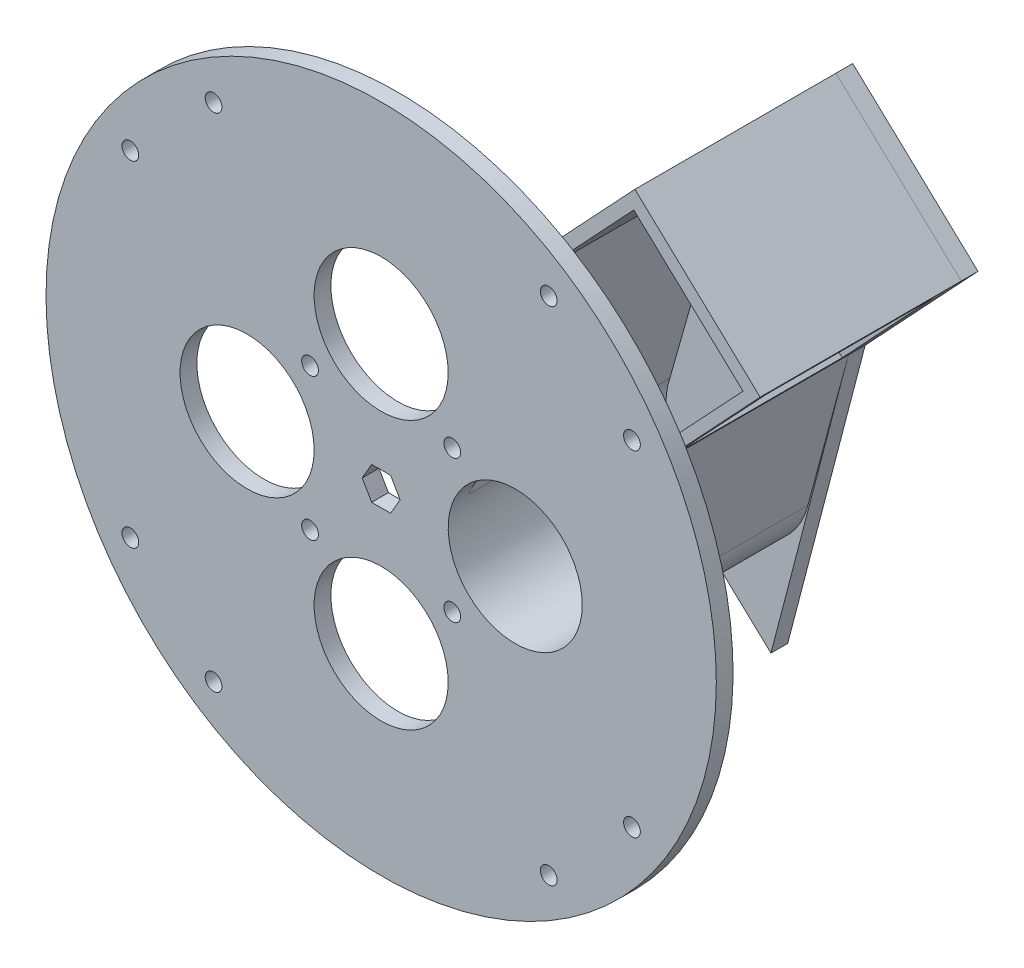
from build123d import *
from build123d.topology import SkipClean

# Parameters (mm, degrees)
SKETCH1_R           = 127
SKETCH1_R_2         = 25.4
BOSS_EXTRUDE1_DEPTH = 6.35
SKETCH3_R           = 3.175
CUT_EXTRUDE1_DEPTH  = 6.35
BOSS_EXTRUDE3_START = 76.2
BOSS_EXTRUDE3_DEPTH = 76.2
SKETCH8_W           = 63.5
SKETCH8_H           = 50.8
CUT_EXTRUDE2_DEPTH  = 6.35
BOSS_EXTRUDE4_DEPTH = 6.35


with BuildPart() as part:
    # Sketch1 → Boss-Extrude1 (new body)
    with BuildSketch(Plane.XY):
        Circle(SKETCH1_R)
        with Locations((0, 50.8)):
            Circle(SKETCH1_R_2, mode=Mode.SUBTRACT)
        with Locations((50.8, 0)):
            Circle(SKETCH1_R_2, mode=Mode.SUBTRACT)
        with Locations((0, -50.8)):
            Circle(SKETCH1_R_2, mode=Mode.SUBTRACT)
        with Locations((-50.8, 0)):
            Circle(SKETCH1_R_2, mode=Mode.SUBTRACT)
        Polygon((7.18570145, 0), (3.592850725, 6.223), (-3.592850725, 6.223), (-7.18570145, 0), (-3.592850725, -6.223), (3.592850725, -6.223), align=None, mode=Mode.SUBTRACT)
    extrude(amount=BOSS_EXTRUDE1_DEPTH)

    # Sketch3 → Cut-Extrude1 (cut)
    with BuildSketch(Plane(origin=(0, 0, 0), x_dir=(-1, 0, 0), z_dir=(0, 0, -1))):
        with Locations((-26.940768363, 26.940768363)):
            Circle(SKETCH3_R)
        with Locations((26.940768363, 26.940768363)):
            Circle(SKETCH3_R)
        with Locations((26.940768363, -26.940768363)):
            Circle(SKETCH3_R)
        with Locations((-26.940768363, -26.940768363)):
            Circle(SKETCH3_R)
        with Locations((-63.5, 95.038097624)):
            Circle(SKETCH3_R)
        with Locations((63.5, 95.038097624)):
            Circle(SKETCH3_R)
        with Locations((95.038097624, 63.5)):
            Circle(SKETCH3_R)
        with Locations((95.038097624, -63.5)):
            Circle(SKETCH3_R)
        with Locations((63.5, -95.038097624)):
            Circle(SKETCH3_R)
        with Locations((-63.5, -95.038097624)):
            Circle(SKETCH3_R)
        with Locations((-95.038097624, -63.5)):
            Circle(SKETCH3_R)
        with Locations((-95.038097624, 63.5)):
            Circle(SKETCH3_R)
    extrude(amount=-CUT_EXTRUDE1_DEPTH, mode=Mode.SUBTRACT)

    # Sketch4 → Boss-Extrude3 (add)
    with SkipClean():  # the faces are left unmerged after this step: merging them gives an invalid solid
        with BuildSketch(Plane(origin=(0, 0, 0), x_dir=(-1, 0, 0), z_dir=(0, 0, -1)).offset(BOSS_EXTRUDE3_START)):
            with BuildLine():
                ThreePointArc((-79.185130885, -7.062226276), (-42.854710858, -28.150720697), (-22.911154448, 8.82060027))
                Line((-22.911154448, 8.82060027), (-27.126431814, 23.771201503))
                ThreePointArc((-27.126431814, 23.771201503), (-29.996629318, 26.079177494), (-28.75477002, 29.546535619))
                Line((-28.75477002, 29.546535619), (-47.031154579, 94.368589733))
                Line((-47.031154579, 94.368589733), (-89.78967593, 140.019925662))
                Line((-89.78967593, 140.019925662), (-137.260674726, 95.557049073))
                Line((-137.260674726, 95.557049073), (-94.502153375, 49.905713144))
                Line((-94.502153375, 49.905713144), (-79.185130885, -7.062226276))
            make_face()
            with BuildLine():
                Line((-91.690310224, 52.539376605), (-130.775049183, 94.268381527))
                Line((-130.775049183, 94.268381527), (-89.388084982, 133.032754057))
                Line((-89.388084982, 133.032754057), (-50.303346023, 91.303749135))
                Line((-50.303346023, 91.303749135), (-26.857967073, 8.48168965))
                ThreePointArc((-26.857967073, 8.48168965), (-43.508670742, -24.330978559), (-75.460781141, -6.083245311))
                Line((-75.460781141, -6.083245311), (-91.690310224, 52.539376605))
            make_face(mode=Mode.SUBTRACT)
        extrude(amount=-BOSS_EXTRUDE3_DEPTH)

    # Sketch8 → Cut-Extrude2 (cut)
    with SkipClean():  # the faces are left unmerged after this step: merging them gives an invalid solid
        with BuildSketch(Plane(origin=(25.440444099, -23.82834478, 0), x_dir=(0, 0, -1), z_dir=(0.729853070223302, -0.683604049055899, 0))):
            with Locations((38.1, 132.300225659)):
                Rectangle(SKETCH8_W, SKETCH8_H)
        extrude(amount=-CUT_EXTRUDE2_DEPTH, mode=Mode.SUBTRACT)


with BuildPart() as body_2:
    # Sketch6 → Boss-Extrude4 (new body)
    with BuildSketch(Plane(origin=(0, 0, -76.2), x_dir=(-1, 0, 0), z_dir=(0, 0, -1))):
        Polygon((-15.801225201, -16.396653006), (-47.031154579, 94.368589733), (-89.78967593, 140.019925662), (-137.260674726, 95.557049073), (-94.502153375, 49.905713144), (-65.150179146, -62.618483276), align=None)
    extrude(amount=BOSS_EXTRUDE4_DEPTH)


solid = Compound([part.part, body_2.part])
